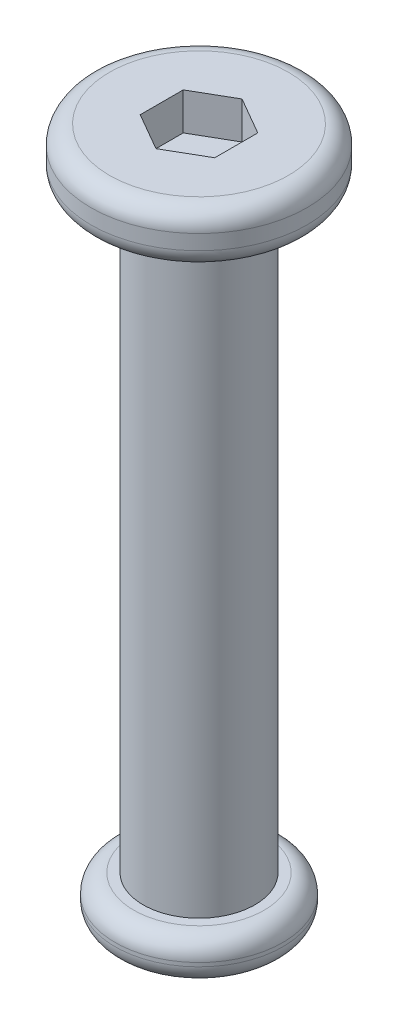
from build123d import *

# Parameters (mm, degrees)
SKETCH_1_R          = 2.9
EXTRUDE_1_DEPTH     = 1.4
CUT_EXTRUDE_1_DEPTH = 1
SKETCH_3_R          = 1.5
EXTRUDE_2_DEPTH     = 16
SKETCH_4_R          = 2.25
EXTRUDE_3_DEPTH     = 1.1
CUT_EXTRUDE_2_DEPTH = 0.8
FILLET_1_R          = 0.5


with BuildPart() as part:
    # 草图1 → 凸台-拉伸1 (new body)
    with BuildSketch(Plane(origin=(0, 0, 0), x_dir=(1, 0, 0), z_dir=(0, 1, 0))):
        with Locations(Location((0, 0, 0), (0, 0, 270))):
            Circle(SKETCH_1_R)
    extrude(amount=EXTRUDE_1_DEPTH)

    # 草图2 → 切除-拉伸1 (cut)
    with BuildSketch(Plane(origin=(0, 1.4, 0), x_dir=(1, 0, 0), z_dir=(0, 1, 0))):
        Polygon((1, 0.577350269), (0, 1.154700538), (-1, 0.577350269), (-1, -0.577350269), (0, -1.154700538), (1, -0.577350269), align=None)
    extrude(amount=-CUT_EXTRUDE_1_DEPTH, mode=Mode.SUBTRACT)

    # 草图3 → 凸台-拉伸2 (add)
    with BuildSketch(Plane.XZ):
        with Locations(Location((0, 0, 0), (0, 0, 270))):
            Circle(SKETCH_3_R)
    extrude(amount=EXTRUDE_2_DEPTH)

    # 草图4 → 凸台-拉伸3 (add)
    with BuildSketch(Plane.XZ.offset(16)):
        with Locations(Location((0, 0, 0), (0, 0, 270))):
            Circle(SKETCH_4_R)
    extrude(amount=EXTRUDE_3_DEPTH)

    # 草图5 → 切除-拉伸2 (cut)
    with BuildSketch(Plane.XZ.offset(17.1)):
        Polygon((0.65, 0.375277675), (0, 0.75055535), (-0.65, 0.375277675), (-0.65, -0.375277675), (0, -0.75055535), (0.65, -0.375277675), align=None)
    extrude(amount=-CUT_EXTRUDE_2_DEPTH, mode=Mode.SUBTRACT)

    # 圆角1
    fillet_1_edges = [part.edges().sort_by_distance(p)[0] for p in [
        (0, 0, -2.9),
        (0, -16, 2.25),
        (0, -17.1, 2.25),
        (0, 1.4, -2.9),
    ]]
    fillet(fillet_1_edges, radius=FILLET_1_R)


solid = part.part
